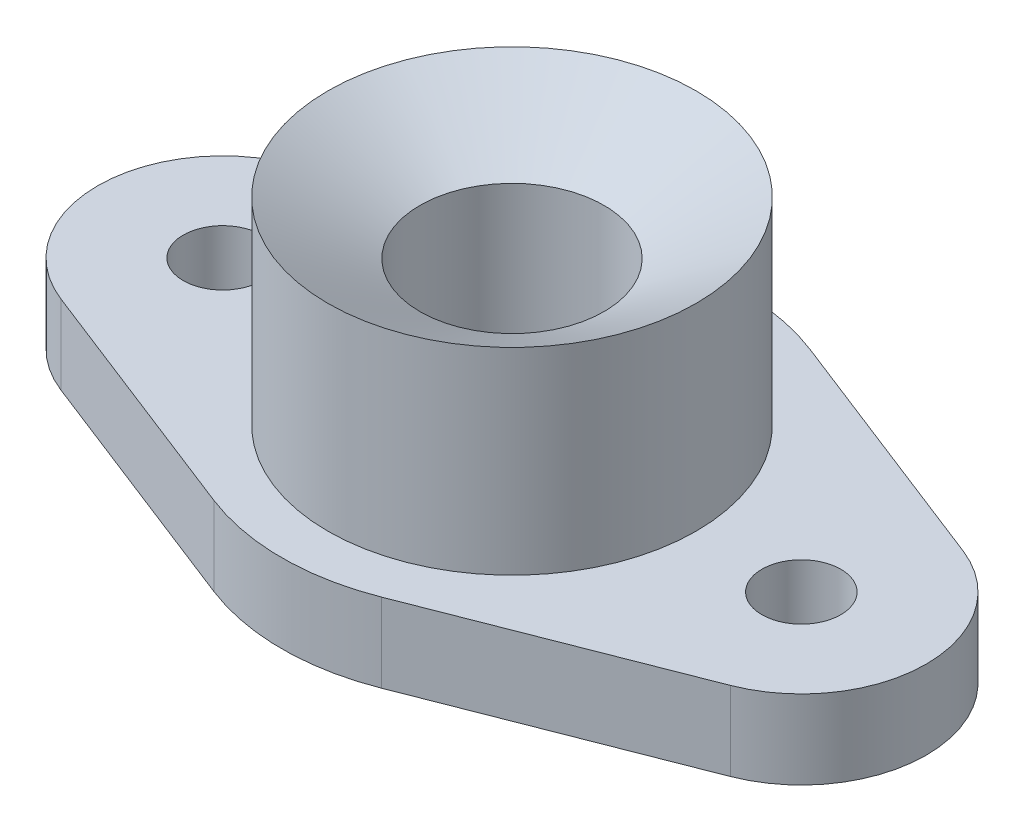
from build123d import *

# Parameters (mm, degrees)
SKETCH1_R                                       = 28
BOSS_EXTRUDE1_DEPTH                             = 42
SKETCH1_3_R                                     = 6
SKETCH1_3_R_2                                   = 28
BOSS_EXTRUDE2_DEPTH                             = 12
CSK_FOR_M2_FLAT_HEAD_MACHINE_SCREW1_D           = 28
CSK_FOR_M2_FLAT_HEAD_MACHINE_SCREW1_CSINK_D     = 56
CSK_FOR_M2_FLAT_HEAD_MACHINE_SCREW1_CSINK_ANGLE = 120


with BuildPart() as part:
    # Sketch1 → Boss-Extrude1 (new body)
    with BuildSketch(Plane(origin=(0, 0, 0), x_dir=(1, 0, 0), z_dir=(0, 1, 0))):
        with Locations(Location((0, 0, 0), (0, 0, 90))):
            Circle(SKETCH1_R)
    extrude(amount=BOSS_EXTRUDE1_DEPTH)

    # Sketch1<3> → Boss-Extrude2 (add)
    with BuildSketch(Plane(origin=(0, 0, 0), x_dir=(1, 0, 0), z_dir=(0, 1, 0))):
        with BuildLine():
            Line((12.727272727, 32.603934255), (50.909090909, 17.699278596))
            ThreePointArc((50.909090909, 17.699278596), (63, 0), (50.909090909, -17.699278596))
            Line((50.909090909, -17.699278596), (12.727272727, -32.603934255))
            ThreePointArc((12.727272727, -32.603934255), (0, -35), (-12.727272727, -32.603934255))
            Line((-12.727272727, -32.603934255), (-50.909090909, -17.699278596))
            ThreePointArc((-50.909090909, -17.699278596), (-63, 0), (-50.909090909, 17.699278596))
            Line((-50.909090909, 17.699278596), (-12.727272727, 32.603934255))
            ThreePointArc((-12.727272727, 32.603934255), (0, 35), (12.727272727, 32.603934255))
        make_face()
        with Locations(Location((44, 0, 0), (0, 0, 270))):
            Circle(SKETCH1_3_R, mode=Mode.SUBTRACT)
        with Locations(Location((-44, 0, 0), (0, 0, 90))):
            Circle(SKETCH1_3_R, mode=Mode.SUBTRACT)
        with Locations(Location((0, 0, 0), (0, 0, 90))):
            Circle(SKETCH1_3_R_2, mode=Mode.SUBTRACT)
    extrude(amount=BOSS_EXTRUDE2_DEPTH)

    # CSK for M2 Flat Head Machine Screw1 (through all)
    with Locations(Plane(origin=(0, 42, 0), x_dir=(1, 0, 0), z_dir=(0, 1, 0))):
        with Locations((0, 0)):
            CounterSinkHole(CSK_FOR_M2_FLAT_HEAD_MACHINE_SCREW1_D / 2, CSK_FOR_M2_FLAT_HEAD_MACHINE_SCREW1_CSINK_D / 2, counter_sink_angle=CSK_FOR_M2_FLAT_HEAD_MACHINE_SCREW1_CSINK_ANGLE)


solid = part.part
